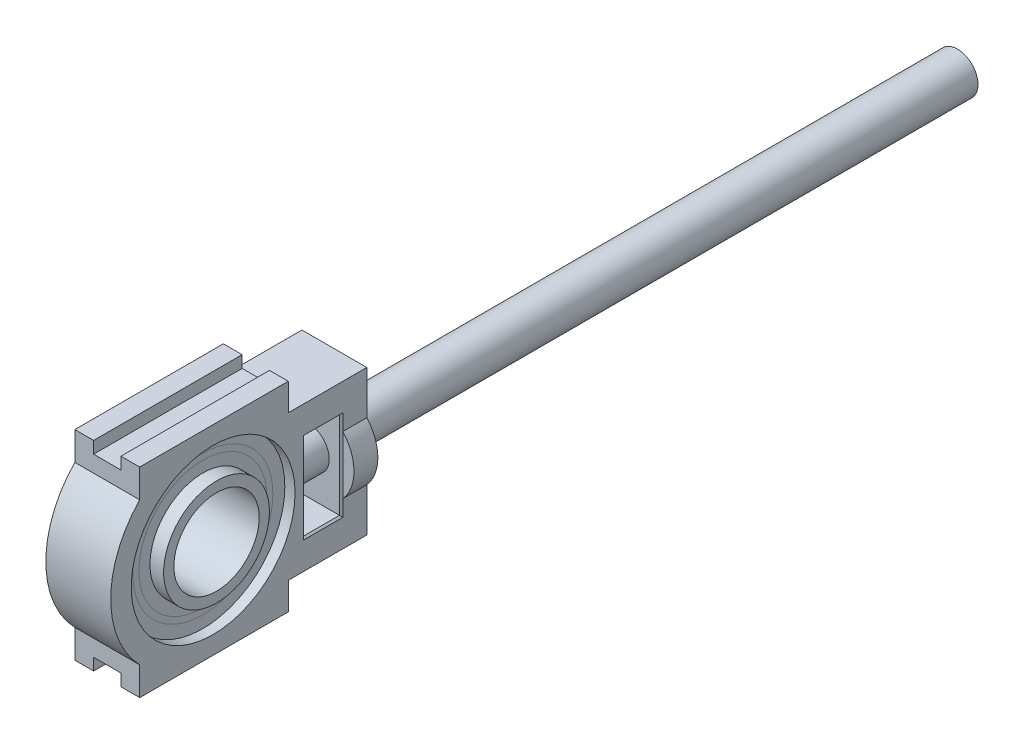
from build123d import *

# Parameters (mm, degrees)
SKETCH1_R                = 48
BOSS_EXTRUDE1_DEPTH      = 19
SKETCH2_R                = 41
SKETCH2_R_2              = 37.5
BOSS_EXTRUDE2_DEPTH      = 13
CUT_EXTRUDE1_DEPTH       = 110.010320612
CUT_EXTRUDE1_DEPTH_BACK  = 110.010320612
SKETCH3_W                = 21
SKETCH3_H                = 51
CHAMFER1_SIZE            = 1
SKETCH4_R                = 25.5
BOSS_EXTRUDE3_DEPTH      = 14
SKETCH5_R                = 12
CUT_EXTRUDE2_DEPTH       = 15
SKETCH6_R                = 48
SKETCH6_R_2              = 41
BOSS_EXTRUDE4_DEPTH      = 13
SKETCH7_R                = 37.5
SKETCH7_R_2              = 31
BOSS_EXTRUDE5_DEPTH      = 13
BOSS_EXTRUDE6_DEPTH      = 21
BOSS_EXTRUDE6_DEPTH_BACK = 31
SKETCH8_R                = 31
SKETCH8_R_2              = 25
CUT_EXTRUDE3_DEPTH       = 112.728465487
CUT_EXTRUDE3_DEPTH_BACK  = 112.728465487
SKETCH9_W                = 16
SKETCH9_H                = 7
BOSS_EXTRUDE7_DEPTH      = 20
BOSS_EXTRUDE7_DEPTH_BACK = 380
SKETCH10_R               = 12


with BuildPart() as part:
    # Sketch1 → Boss-Extrude1 (new, symmetric)
    with BuildSketch(Plane(origin=(0, 0, 0), x_dir=(0, 0, -1), z_dir=(1, 0, 0))):
        with BuildLine():
            Line((-43, 41.844951906), (-43, 58.5))
            Line((-43, 58.5), (44, 58.5))
            Line((44, 58.5), (44, 42.5))
            Line((44, 42.5), (90, 42.5))
            Line((90, 42.5), (90, -42.5))
            Line((90, -42.5), (44, -42.5))
            Line((44, -42.5), (44, -58.5))
            Line((44, -58.5), (-43, -58.5))
            Line((-43, -58.5), (-43, -41.844951906))
            ThreePointArc((-43, -41.844951906), (-60, 0), (-43, 41.844951906))
        make_face()
        Circle(SKETCH1_R, mode=Mode.SUBTRACT)
    extrude(amount=BOSS_EXTRUDE1_DEPTH, both=True)

    # Sketch3 → Cut-Extrude1 (cut, two sides: drawn at the far end of the back side and taken through both)
    with BuildSketch(Plane(origin=(0, 0, 0), x_dir=(0, 0, -1), z_dir=(1, 0, 0)).offset(-CUT_EXTRUDE1_DEPTH_BACK)):
        with Locations((64.5, 0)):
            Rectangle(SKETCH3_W, SKETCH3_H)
    extrude(amount=CUT_EXTRUDE1_DEPTH + CUT_EXTRUDE1_DEPTH_BACK, mode=Mode.SUBTRACT)

    # Chamfer1
    chamfer1_edges = [part.edges().sort_by_distance(p)[0] for p in [
        (-19, 0, -54),
        (-19, 25.5, -64.5),
        (-19, 0, -75),
        (-19, -25.5, -64.5),
        (19, 0, -54),
        (19, -25.5, -64.5),
        (19, 0, -75),
        (19, 25.5, -64.5),
    ]]
    chamfer(chamfer1_edges, length=CHAMFER1_SIZE)

    # Sketch4 → Boss-Extrude3 (add)
    with BuildSketch(Plane(origin=(0, 0, -90), x_dir=(-1, 0, 0), z_dir=(0, 0, -1))):
        Circle(SKETCH4_R)
    extrude(amount=-BOSS_EXTRUDE3_DEPTH)

    # Sketch5 → Cut-Extrude2 (cut)
    with BuildSketch(Plane(origin=(0, 0, -90), x_dir=(-1, 0, 0), z_dir=(0, 0, -1))):
        Circle(SKETCH5_R)
    extrude(amount=-CUT_EXTRUDE2_DEPTH, mode=Mode.SUBTRACT)

    # Sketch9 → Cut-Extrude3 (cut, two sides: drawn at the far end of the back side and taken through both)
    with BuildSketch(Plane.XY.offset(-CUT_EXTRUDE3_DEPTH_BACK)):
        with Locations((0, -55)):
            Rectangle(SKETCH9_W, SKETCH9_H)
        with Locations((0, 55)):
            Rectangle(SKETCH9_W, SKETCH9_H)
    extrude(amount=CUT_EXTRUDE3_DEPTH + CUT_EXTRUDE3_DEPTH_BACK, mode=Mode.SUBTRACT)


with BuildPart() as body_2:
    # Sketch2 → Boss-Extrude2 (new body)
    with BuildSketch(Plane(origin=(0, 0, 0), x_dir=(0, 0, -1), z_dir=(1, 0, 0))):
        Circle(SKETCH2_R)
        Circle(SKETCH2_R_2, mode=Mode.SUBTRACT)
    extrude(amount=BOSS_EXTRUDE2_DEPTH)


with BuildPart() as body_3:
    # Sketch6 → Boss-Extrude4 (new body)
    with BuildSketch(Plane(origin=(0, 0, 0), x_dir=(0, 0, -1), z_dir=(1, 0, 0))):
        Circle(SKETCH6_R)
        Circle(SKETCH6_R_2, mode=Mode.SUBTRACT)
    extrude(amount=BOSS_EXTRUDE4_DEPTH)


with BuildPart() as body_4:
    # Sketch7 → Boss-Extrude5 (new body)
    with BuildSketch(Plane(origin=(0, 0, 0), x_dir=(0, 0, -1), z_dir=(1, 0, 0))):
        Circle(SKETCH7_R)
        Circle(SKETCH7_R_2, mode=Mode.SUBTRACT)
    extrude(amount=BOSS_EXTRUDE5_DEPTH)


with BuildPart() as body_5:
    # Sketch8 → Boss-Extrude6 (new, two sides: drawn at the far end of the back side and taken through both)
    with BuildSketch(Plane(origin=(0, 0, 0), x_dir=(0, 0, -1), z_dir=(1, 0, 0)).offset(-BOSS_EXTRUDE6_DEPTH_BACK)):
        Circle(SKETCH8_R)
        Circle(SKETCH8_R_2, mode=Mode.SUBTRACT)
    extrude(amount=BOSS_EXTRUDE6_DEPTH + BOSS_EXTRUDE6_DEPTH_BACK)


with BuildPart() as body_6:
    # Mirror1: mirrored copy
    add(body_3.part.mirror(Plane(origin=(0, 0, 0), x_dir=(0, 0, 1), z_dir=(1, 0, 0))))


with BuildPart() as body_7:
    # Mirror1 2: mirrored copy
    add(body_2.part.mirror(Plane(origin=(0, 0, 0), x_dir=(0, 0, 1), z_dir=(1, 0, 0))))


with BuildPart() as body_8:
    # Mirror1 3: mirrored copy
    add(body_4.part.mirror(Plane(origin=(0, 0, 0), x_dir=(0, 0, 1), z_dir=(1, 0, 0))))


with BuildPart() as body_9:
    # Sketch10 → Boss-Extrude7 (new, two sides: drawn at the far end of the back side and taken through both)
    with BuildSketch(Plane.XY.offset(-75).offset(-BOSS_EXTRUDE7_DEPTH_BACK)):
        Circle(SKETCH10_R)
    extrude(amount=BOSS_EXTRUDE7_DEPTH + BOSS_EXTRUDE7_DEPTH_BACK)


solid = Compound([part.part, body_2.part, body_3.part, body_4.part, body_5.part, body_6.part, body_7.part, body_8.part, body_9.part])
